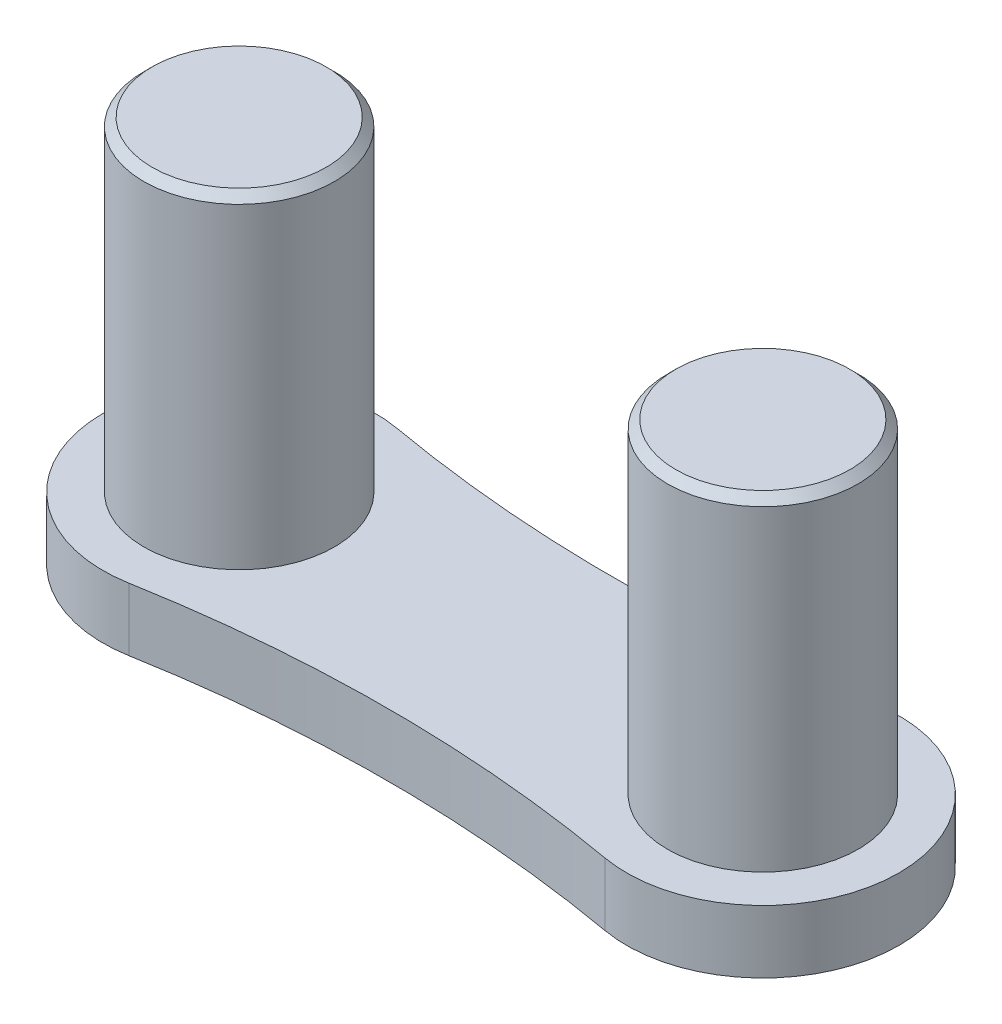
from build123d import *

# Parameters (mm, degrees)
BOSS_EXTRUDE1_DEPTH = 0.762
SKETCH3_R           = 1.1557
BOSS_EXTRUDE2_DEPTH = 3.937
CHAMFER1_SIZE       = 0.1


with BuildPart() as part:
    # Sketch2 → Boss-Extrude1 (new body)
    with BuildSketch(Plane(origin=(0, 0, 0), x_dir=(1, 0, 0), z_dir=(0, 1, 0))):
        with BuildLine():
            ThreePointArc((-2.886363636, 1.62557376), (-4.826, 0), (-2.886363636, -1.62557376))
            ThreePointArc((-2.886363636, -1.62557376), (0, -1.371311361), (2.886363636, -1.62557376))
            ThreePointArc((2.886363636, -1.62557376), (4.826, 0), (2.886363636, 1.62557376))
            ThreePointArc((2.886363636, 1.62557376), (0, 1.371311361), (-2.886363636, 1.62557376))
        make_face()
    extrude(amount=BOSS_EXTRUDE1_DEPTH)

    # Sketch3 → Boss-Extrude2 (add)
    with BuildSketch(Plane(origin=(0, 0.762, 0), x_dir=(1, 0, 0), z_dir=(0, 1, 0))):
        with Locations(Location((-3.175, 0, 0), (0, 0, 270))):
            Circle(SKETCH3_R)
        with Locations(Location((3.175, 0, 0), (0, 0, 270))):
            Circle(SKETCH3_R)
    extrude(amount=BOSS_EXTRUDE2_DEPTH)

    # Chamfer1
    chamfer1_edges = [part.edges().sort_by_distance(p)[0] for p in [
        (-3.175, 4.699, -1.1557),
        (3.175, 4.699, -1.1557),
    ]]
    chamfer(chamfer1_edges, length=CHAMFER1_SIZE)


solid = part.part
